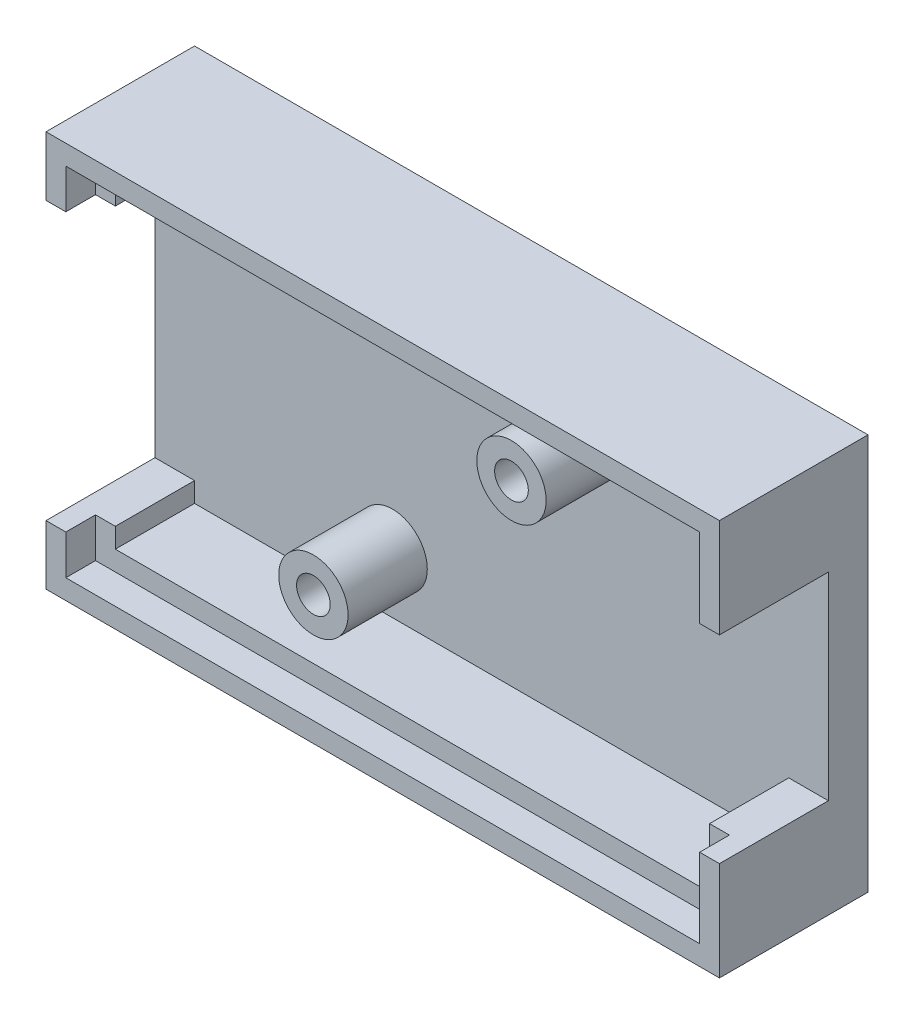
from build123d import *

# Parameters (mm, degrees)
SKETCH_1_W          = 34
SKETCH_1_H          = 20
EXTRUDE_1_DEPTH     = 7.5
SKETCH_2_W          = 30
SKETCH_2_H          = 16
CUT_EXTRUDE_1_DEPTH = 5.5
SKETCH_3_W          = 5.5
SKETCH_3_H          = 10
CUT_EXTRUDE_2_DEPTH = 2
SKETCH_4_W          = 5.5
SKETCH_4_H          = 14
CUT_EXTRUDE_3_DEPTH = 2
CUT_EXTRUDE_4_DEPTH = 1.5
SKETCH_6_R          = 1.75
EXTRUDE_2_DEPTH     = 4
SKETCH_7_R          = 0.85
CUT_EXTRUDE_5_DEPTH = 3


with BuildPart() as part:
    # 草图1 → 凸台-拉伸1 (new body)
    with BuildSketch(Plane.XY):
        Rectangle(SKETCH_1_W, SKETCH_1_H)
    extrude(amount=EXTRUDE_1_DEPTH)

    # 草图2 → 切除-拉伸1 (cut)
    with BuildSketch(Plane.XY.offset(7.5)):
        Rectangle(SKETCH_2_W, SKETCH_2_H)
    extrude(amount=-CUT_EXTRUDE_1_DEPTH, mode=Mode.SUBTRACT)

    # 草图3 → 切除-拉伸2 (cut)
    with BuildSketch(Plane(origin=(17, 0, 0), x_dir=(0, 0, -1), z_dir=(1, 0, 0))):
        with Locations((-4.75, 0)):
            Rectangle(SKETCH_3_W, SKETCH_3_H)
    extrude(amount=-CUT_EXTRUDE_2_DEPTH, mode=Mode.SUBTRACT)

    # 草图4 → 切除-拉伸3 (cut)
    with BuildSketch(Plane.ZY.offset(17)):
        with Locations((4.75, 0)):
            Rectangle(SKETCH_4_W, SKETCH_4_H)
    extrude(amount=-CUT_EXTRUDE_3_DEPTH, mode=Mode.SUBTRACT)

    # 草图5 → 切除-拉伸4 (cut)
    with BuildSketch(Plane.XY.offset(7.5)):
        Polygon((-16, 7), (-16, 9), (16, 9), (16, 5), (15, 5), (15, 8), (-15, 8), (-15, 7), align=None)
        Polygon((-15, -7), (-15, -8), (15, -8), (15, -5), (16, -5), (16, -9), (-16, -9), (-16, -7), align=None)
    extrude(amount=-CUT_EXTRUDE_4_DEPTH, mode=Mode.SUBTRACT)

    # 草图6 → 凸台-拉伸2 (add)
    with BuildSketch(Plane.XY.offset(2)):
        with Locations((5, 5)):
            Circle(SKETCH_6_R)
        with Locations((-5, -5)):
            Circle(SKETCH_6_R)
    extrude(amount=EXTRUDE_2_DEPTH)

    # 草图7 → 切除-拉伸5 (cut)
    with BuildSketch(Plane.XY.offset(6)):
        with Locations((-5, -5)):
            Circle(SKETCH_7_R)
        with Locations((5, 5)):
            Circle(SKETCH_7_R)
    extrude(amount=-CUT_EXTRUDE_5_DEPTH, mode=Mode.SUBTRACT)


solid = part.part
